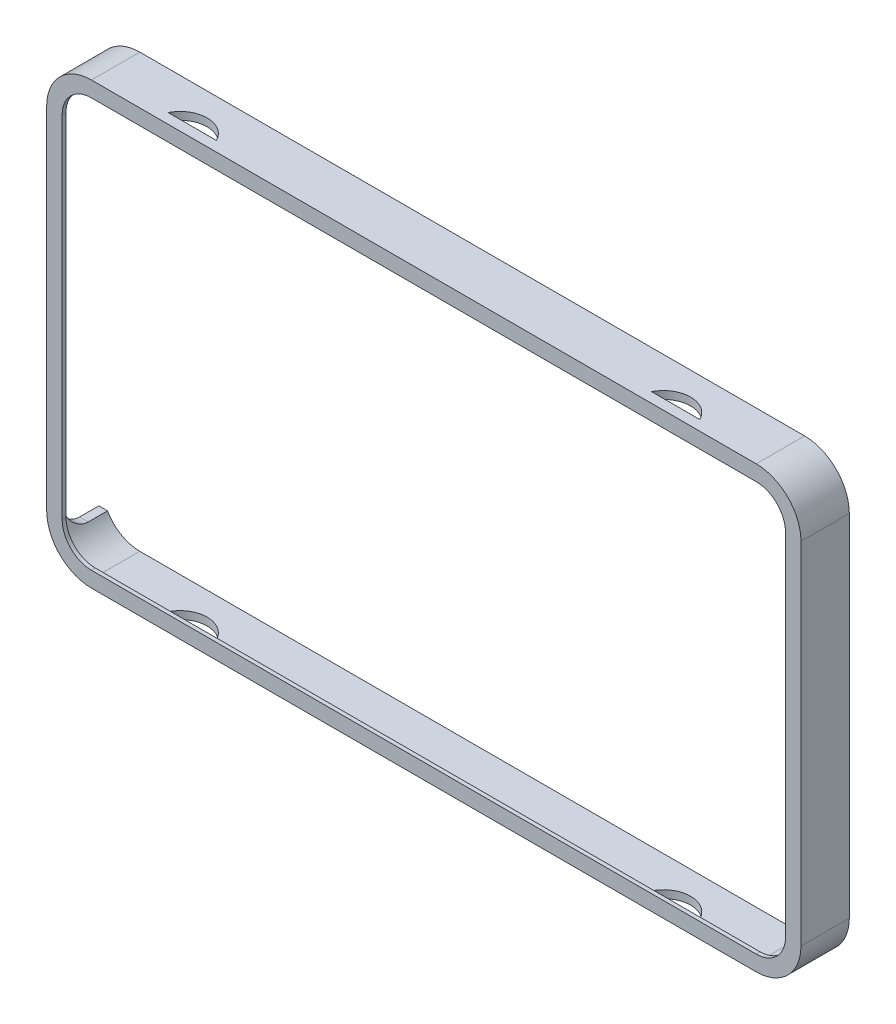
from build123d import *

# Parameters (mm, degrees)
BOSS_EXTRUDE1_DEPTH = 12.7
BOSS_EXTRUDE2_DEPTH = 1.016
CUT_EXTRUDE1_REACH  = 208.793
CUT_EXTRUDE2_DEPTH  = 153.771026153


with BuildPart() as part:
    # Sketch1 → Boss-Extrude1 (new body)
    with BuildSketch(Plane.XY):
        with BuildLine():
            Line((-99.0727, 46.0375), (-99.0727, -46.0375))
            ThreePointArc((-99.0727, -46.0375), (-95.628217168, -54.353217168), (-87.3125, -57.7977))
            Line((-87.3125, -57.7977), (87.3125, -57.7977))
            ThreePointArc((87.3125, -57.7977), (95.628217168, -54.353217168), (99.0727, -46.0375))
            Line((99.0727, -46.0375), (99.0727, 46.0375))
            ThreePointArc((99.0727, 46.0375), (95.628217168, 54.353217168), (87.3125, 57.7977))
            Line((87.3125, 57.7977), (-87.3125, 57.7977))
            ThreePointArc((-87.3125, 57.7977), (-95.628217168, 54.353217168), (-99.0727, 46.0375))
        make_face()
        with BuildLine():
            Line((87.3125, 55.7657), (-87.3125, 55.7657))
            ThreePointArc((-87.3125, 55.7657), (-94.191376189, 52.916376189), (-97.0407, 46.0375))
            Line((-97.0407, 46.0375), (-97.0407, -46.0375))
            ThreePointArc((-97.0407, -46.0375), (-94.191376189, -52.916376189), (-87.3125, -55.7657))
            Line((-87.3125, -55.7657), (87.3125, -55.7657))
            ThreePointArc((87.3125, -55.7657), (94.191376189, -52.916376189), (97.0407, -46.0375))
            Line((97.0407, -46.0375), (97.0407, 46.0375))
            ThreePointArc((97.0407, 46.0375), (94.191376189, 52.916376189), (87.3125, 55.7657))
        make_face(mode=Mode.SUBTRACT)
    extrude(amount=-BOSS_EXTRUDE1_DEPTH)

    # Sketch2 → Boss-Extrude2 (add)
    with BuildSketch(Plane.XY):
        with BuildLine():
            Line((-97.0407, 46.0375), (-97.0407, -46.0375))
            ThreePointArc((-97.0407, -46.0375), (-94.191376189, -52.916376189), (-87.3125, -55.7657))
            Line((-87.3125, -55.7657), (87.3125, -55.7657))
            ThreePointArc((87.3125, -55.7657), (94.191376189, -52.916376189), (97.0407, -46.0375))
            Line((97.0407, -46.0375), (97.0407, 46.0375))
            ThreePointArc((97.0407, 46.0375), (94.191376189, 52.916376189), (87.3125, 55.7657))
            Line((87.3125, 55.7657), (-87.3125, 55.7657))
            ThreePointArc((-87.3125, 55.7657), (-94.191376189, 52.916376189), (-97.0407, 46.0375))
        make_face()
        with BuildLine():
            Line((-95.0087, 46.0375), (-95.0087, -46.0375))
            ThreePointArc((-95.0087, -46.0375), (-92.754535209, -51.479535209), (-87.3125, -53.7337))
            Line((-87.3125, -53.7337), (87.3125, -53.7337))
            ThreePointArc((87.3125, -53.7337), (92.754535209, -51.479535209), (95.0087, -46.0375))
            Line((95.0087, -46.0375), (95.0087, 46.0375))
            ThreePointArc((95.0087, 46.0375), (92.754535209, 51.479535209), (87.3125, 53.7337))
            Line((87.3125, 53.7337), (-87.3125, 53.7337))
            ThreePointArc((-87.3125, 53.7337), (-92.754535209, 51.479535209), (-95.0087, 46.0375))
        make_face(mode=Mode.SUBTRACT)
    extrude(amount=-BOSS_EXTRUDE2_DEPTH)

    # Sketch3 → Cut-Extrude1 (cut, up to next)
    with BuildSketch(Plane.ZY.offset(99.0727), mode=Mode.PRIVATE) as cut_extrude1_sk1:
        with BuildLine():
            Line((-12.7, 50.8), (-7.637414644, 50.8))
            ThreePointArc((-7.637414644, 50.8), (-4.045312196, 49.312102448), (-2.557414644, 45.72))
            Line((-2.557414644, 45.72), (-2.557414644, -45.72))
            ThreePointArc((-2.557414644, -45.72), (-4.045312196, -49.312102448), (-7.637414644, -50.8))
            Line((-7.637414644, -50.8), (-12.7, -50.8))
            Line((-12.7, -50.8), (-12.7, 50.8))
        make_face()
    cut_extrude1_tool1 = extrude(cut_extrude1_sk1.sketch, amount=-CUT_EXTRUDE1_REACH, mode=Mode.PRIVATE) & part.part
    add(cut_extrude1_tool1.solids().sort_by_distance((-99.0727, 0, -7.671479))[0], mode=Mode.SUBTRACT)

    # Sketch4 → Cut-Extrude2 (cut, through all)
    with BuildSketch(Plane(origin=(0, 57.7977, 0), x_dir=(1, 0, 0), z_dir=(0, 1, 0))):
        with BuildLine():
            Line((-69.85, 2.667), (-57.15, 2.667))
            ThreePointArc((-57.15, 2.667), (-63.5, 6.576181866), (-69.85, 2.667))
        make_face()
        with BuildLine():
            Line((69.85, 2.667), (57.15, 2.667))
            ThreePointArc((57.15, 2.667), (63.5, 6.576181866), (69.85, 2.667))
        make_face()
    extrude(amount=-CUT_EXTRUDE2_DEPTH, mode=Mode.SUBTRACT)


solid = part.part
